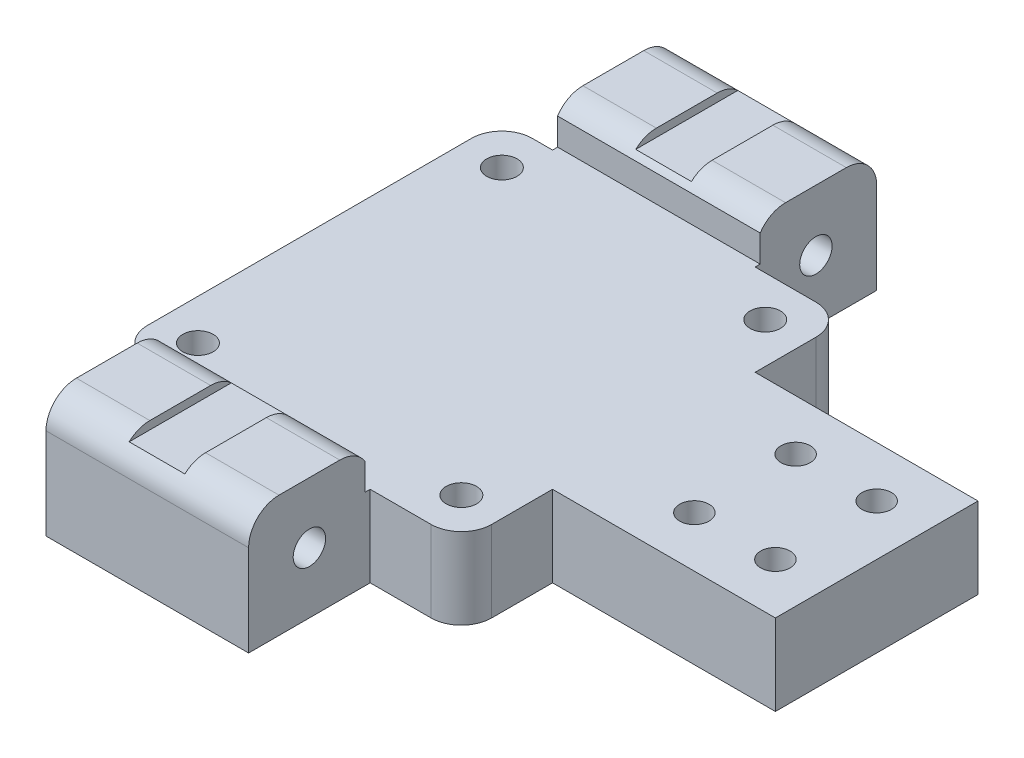
from build123d import *

# Parameters (mm, degrees)
SKETCH1_W            = 300
SKETCH1_H            = 20
BOSS_EXTRUDE1_DEPTH  = 8
SKETCH2_W            = 34
SKETCH2_H            = 8
BOSS_EXTRUDE2_DEPTH  = 9
SKETCH3_W            = 34
SKETCH3_H            = 8
BOSS_EXTRUDE3_DEPTH  = 9
SKETCH4_R            = 1.5
CUT_EXTRUDE1_DEPTH   = 302.504560496
SKETCH5_W            = 25
SKETCH5_H            = 8
BOSS_EXTRUDE4_DEPTH  = 17
SKETCH6_W            = 25
SKETCH6_H            = 8
BOSS_EXTRUDE5_DEPTH  = 17
SKETCH7_W            = 10
SKETCH7_H            = 38
CUT_EXTRUDE2_DEPTH   = 303.37890138
SKETCH8_W            = 7
SKETCH8_H            = 16
CUT_EXTRUDE3_DEPTH   = 4
CUT_EXTRUDE4_DEPTH   = 7
BOSS_EXTRUDE6_DEPTH  = 10
SKETCH12_W           = 8
SKETCH12_H           = 8
BOSS_EXTRUDE7_DEPTH  = 17
SKETCH13_R           = 1.7
CUT_EXTRUDE6_DEPTH   = 305.926220585
SKETCH14_W           = 20
SKETCH14_H           = 13
BOSS_EXTRUDE8_DEPTH  = 12
SKETCH15_R           = 1.6
CUT_EXTRUDE7_DEPTH   = 20
SKETCH16_W           = 20
SKETCH16_H           = 13
BOSS_EXTRUDE9_DEPTH  = 12
SKETCH17_R           = 1.6
CUT_EXTRUDE8_DEPTH   = 20
SKETCH18_W           = 20
SKETCH18_H           = 12
BOSS_EXTRUDE10_DEPTH = 12
SKETCH19_R           = 1.6
CUT_EXTRUDE9_DEPTH   = 20
SKETCH20_W           = 20
SKETCH20_H           = 12
BOSS_EXTRUDE11_DEPTH = 12
SKETCH21_R           = 1.6
CUT_EXTRUDE10_DEPTH  = 20
FILLET6_R            = 3
SKETCH22_W           = 123.750788161
SKETCH22_H           = 72.639217631
CUT_EXTRUDE11_DEPTH  = 244
SKETCH23_R           = 1.45
CUT_EXTRUDE12_DEPTH  = 71.434366612
FILLET7_R            = 3
SKETCH24_W           = 5.5
SKETCH24_H           = 78.243551934
CUT_EXTRUDE13_DEPTH  = 0.8
SKETCH25_W           = 20
SKETCH25_H           = 5.75655834
CUT_EXTRUDE14_DEPTH  = 0.5
SKETCH26_W           = 20
SKETCH26_H           = 21.459079842
CUT_EXTRUDE15_DEPTH  = 0.5


with BuildPart() as part:
    # Sketch1 → Boss-Extrude1 (new body)
    with BuildSketch(Plane(origin=(0, 0, 0), x_dir=(1, 0, 0), z_dir=(0, 1, 0))):
        with Locations((150, -10)):
            Rectangle(SKETCH1_W, SKETCH1_H)
    extrude(amount=BOSS_EXTRUDE1_DEPTH)

    # Sketch2 → Boss-Extrude2 (add)
    with BuildSketch(Plane.XY.offset(20)):
        with Locations((17, 4)):
            Rectangle(SKETCH2_W, SKETCH2_H)
        with Locations((283, 4)):
            Rectangle(SKETCH2_W, SKETCH2_H)
    extrude(amount=BOSS_EXTRUDE2_DEPTH)

    # Sketch3 → Boss-Extrude3 (add)
    with BuildSketch(Plane(origin=(0, 0, 0), x_dir=(-1, 0, 0), z_dir=(0, 0, -1))):
        with Locations((-17, 4)):
            Rectangle(SKETCH3_W, SKETCH3_H)
        with Locations((-283, 4)):
            Rectangle(SKETCH3_W, SKETCH3_H)
    extrude(amount=BOSS_EXTRUDE3_DEPTH)

    # Sketch4 → Cut-Extrude1 (cut, through all)
    with BuildSketch(Plane(origin=(0, 8, 0), x_dir=(1, 0, 0), z_dir=(0, 1, 0))):
        with Locations(Location((4, 5, 0), (0, 0, 270))):
            Circle(SKETCH4_R)
        with Locations(Location((30, 5, 0), (0, 0, 270))):
            Circle(SKETCH4_R)
        with Locations(Location((30, -25, 0), (0, 0, 270))):
            Circle(SKETCH4_R)
        with Locations(Location((4, -25, 0), (0, 0, 270))):
            Circle(SKETCH4_R)
        with Locations(Location((296, -25, 0), (0, 0, 270))):
            Circle(SKETCH4_R)
        with Locations(Location((296, 5, 0), (0, 0, 270))):
            Circle(SKETCH4_R)
        with Locations(Location((270, -25, 0), (0, 0, 270))):
            Circle(SKETCH4_R)
        with Locations(Location((270, 5, 0), (0, 0, 270))):
            Circle(SKETCH4_R)
    extrude(amount=-CUT_EXTRUDE1_DEPTH, mode=Mode.SUBTRACT)

    # Sketch5 → Boss-Extrude4 (add)
    with BuildSketch(Plane.XY.offset(20)):
        with Locations((253.5, 4)):
            Rectangle(SKETCH5_W, SKETCH5_H)
    extrude(amount=BOSS_EXTRUDE4_DEPTH)

    # Sketch6 → Boss-Extrude5 (add)
    with BuildSketch(Plane(origin=(0, 0, 0), x_dir=(-1, 0, 0), z_dir=(0, 0, -1))):
        with Locations((-253.5, 4)):
            Rectangle(SKETCH6_W, SKETCH6_H)
    extrude(amount=BOSS_EXTRUDE5_DEPTH)

    # Sketch7 → Cut-Extrude2 (cut, through all)
    with BuildSketch(Plane(origin=(0, 8, 0), x_dir=(1, 0, 0), z_dir=(0, 1, 0))):
        with Locations((254, -10)):
            Rectangle(SKETCH7_W, SKETCH7_H)
    extrude(amount=-CUT_EXTRUDE2_DEPTH, mode=Mode.SUBTRACT)

    # Sketch8 → Cut-Extrude3 (cut)
    with BuildSketch(Plane(origin=(0, 8, 0), x_dir=(1, 0, 0), z_dir=(0, 1, 0))):
        with Locations((262.5, -10)):
            Rectangle(SKETCH8_W, SKETCH8_H)
    extrude(amount=-CUT_EXTRUDE3_DEPTH, mode=Mode.SUBTRACT)

    # Sketch9 → Cut-Extrude4 (cut)
    with BuildSketch(Plane.ZY.offset(-259)):
        Polygon((18, 4), (22, 8), (18, 8), align=None)
        Polygon((2, 4), (-2, 8), (2, 8), align=None)
    extrude(amount=-CUT_EXTRUDE4_DEPTH, mode=Mode.SUBTRACT)

    # Sketch10 → Boss-Extrude6 (add)
    with BuildSketch(Plane.ZY.offset(-259)):
        Polygon((-2, 0), (-9, 8), (-9, 0), align=None)
        Polygon((29, 8), (22, 0), (29, 0), align=None)
    extrude(amount=BOSS_EXTRUDE6_DEPTH)

    # Sketch12 → Boss-Extrude7 (add)
    with BuildSketch(Plane.XY.offset(37)):
        with Locations((245, 4)):
            Rectangle(SKETCH12_W, SKETCH12_H)
    extrude(amount=BOSS_EXTRUDE7_DEPTH)

    # Sketch13 → Cut-Extrude6 (cut, through all)
    with BuildSketch(Plane(origin=(0, 8, 0), x_dir=(1, 0, 0), z_dir=(0, 1, 0))):
        with Locations(Location((245, -50, 0), (0, 0, 270))):
            Circle(SKETCH13_R)
        with Locations(Location((245, -18, 0), (0, 0, 270))):
            Circle(SKETCH13_R)
    extrude(amount=-CUT_EXTRUDE6_DEPTH, mode=Mode.SUBTRACT)

    # Sketch14 → Boss-Extrude8 (add)
    with BuildSketch(Plane.XY.offset(29)):
        with Locations((285, 6.5)):
            Rectangle(SKETCH14_W, SKETCH14_H)
    extrude(amount=BOSS_EXTRUDE8_DEPTH)

    # Sketch15 → Cut-Extrude7 (cut)
    with BuildSketch(Plane(origin=(295, 0, 0), x_dir=(0, 0, -1), z_dir=(1, 0, 0))):
        with Locations((-35, 8)):
            Circle(SKETCH15_R)
    extrude(amount=-CUT_EXTRUDE7_DEPTH, mode=Mode.SUBTRACT)

    # Sketch16 → Boss-Extrude9 (add)
    with BuildSketch(Plane(origin=(0, 0, -9), x_dir=(-1, 0, 0), z_dir=(0, 0, -1))):
        with Locations((-285, 6.5)):
            Rectangle(SKETCH16_W, SKETCH16_H)
    extrude(amount=BOSS_EXTRUDE9_DEPTH)

    # Sketch17 → Cut-Extrude8 (cut)
    with BuildSketch(Plane(origin=(295, 0, 0), x_dir=(0, 0, -1), z_dir=(1, 0, 0))):
        with Locations((15, 8)):
            Circle(SKETCH17_R)
    extrude(amount=-CUT_EXTRUDE8_DEPTH, mode=Mode.SUBTRACT)

    # Sketch18 → Boss-Extrude10 (add)
    with BuildSketch(Plane(origin=(0, 0, -9), x_dir=(-1, 0, 0), z_dir=(0, 0, -1))):
        with Locations((-15, 6)):
            Rectangle(SKETCH18_W, SKETCH18_H)
    extrude(amount=BOSS_EXTRUDE10_DEPTH)

    # Sketch19 → Cut-Extrude9 (cut)
    with BuildSketch(Plane.ZY.offset(-5)):
        with Locations((-15, 6)):
            Circle(SKETCH19_R)
    extrude(amount=-CUT_EXTRUDE9_DEPTH, mode=Mode.SUBTRACT)

    # Sketch20 → Boss-Extrude11 (add)
    with BuildSketch(Plane.XY.offset(29)):
        with Locations((15, 6)):
            Rectangle(SKETCH20_W, SKETCH20_H)
    extrude(amount=BOSS_EXTRUDE11_DEPTH)

    # Sketch21 → Cut-Extrude10 (cut)
    with BuildSketch(Plane.ZY.offset(-5)):
        with Locations((35, 6)):
            Circle(SKETCH21_R)
    extrude(amount=-CUT_EXTRUDE10_DEPTH, mode=Mode.SUBTRACT)

    # Fillet6
    fillet6_edges = [part.edges().sort_by_distance(p)[0] for p in [
        (285, 13, 29),
        (285, 13, 41),
        (285, 13, -9),
        (285, 13, -21),
        (15, 12, -9),
        (15, 12, -21),
        (15, 12, 29),
        (15, 12, 41),
    ]]
    fillet(fillet6_edges, radius=FILLET6_R)

    # Sketch22 → Cut-Extrude11 (cut)
    with BuildSketch(Plane(origin=(300, 0, 0), x_dir=(0, 0, -1), z_dir=(1, 0, 0))):
        with Locations((-10.128058827, -1.301866478)):
            Rectangle(SKETCH22_W, SKETCH22_H)
    extrude(amount=-CUT_EXTRUDE11_DEPTH, mode=Mode.SUBTRACT)

    # Sketch23 → Cut-Extrude12 (cut, through all)
    with BuildSketch(Plane(origin=(0, 0, 0), x_dir=(-1, 0, 0), z_dir=(0, -1, 0))):
        with Locations(Location((-51, -5, 0), (0, 0, 90))):
            Circle(SKETCH23_R)
        with Locations(Location((-51, -15, 0), (0, 0, 90))):
            Circle(SKETCH23_R)
        with Locations(Location((-43, -5, 0), (0, 0, 90))):
            Circle(SKETCH23_R)
        with Locations(Location((-43, -15, 0), (0, 0, 90))):
            Circle(SKETCH23_R)
    extrude(amount=-CUT_EXTRUDE12_DEPTH, mode=Mode.SUBTRACT)

    # Fillet7
    fillet7_edges = [part.edges().sort_by_distance(p)[0] for p in [
        (0, 4, 29),
        (34, 4, 29),
        (0, 4, -9),
        (34, 4, -9),
    ]]
    fillet(fillet7_edges, radius=FILLET7_R)

    # Sketch24 → Cut-Extrude13 (cut)
    with BuildSketch(Plane(origin=(0, 12, 0), x_dir=(1, 0, 0), z_dir=(0, 1, 0))):
        with Locations((15, -9.577024089)):
            Rectangle(SKETCH24_W, SKETCH24_H)
    extrude(amount=-CUT_EXTRUDE13_DEPTH, mode=Mode.SUBTRACT)

    # Sketch25 → Cut-Extrude14 (cut)
    with BuildSketch(Plane(origin=(0, 0, 29), x_dir=(-1, 0, 0), z_dir=(0, 0, -1))):
        with Locations((-15, 10.87827917)):
            Rectangle(SKETCH25_W, SKETCH25_H)
    extrude(amount=-CUT_EXTRUDE14_DEPTH, mode=Mode.SUBTRACT)

    # Sketch26 → Cut-Extrude15 (cut)
    with BuildSketch(Plane.XY.offset(-9)):
        with Locations((15, 18.729539921)):
            Rectangle(SKETCH26_W, SKETCH26_H)
    extrude(amount=-CUT_EXTRUDE15_DEPTH, mode=Mode.SUBTRACT)


solid = part.part
